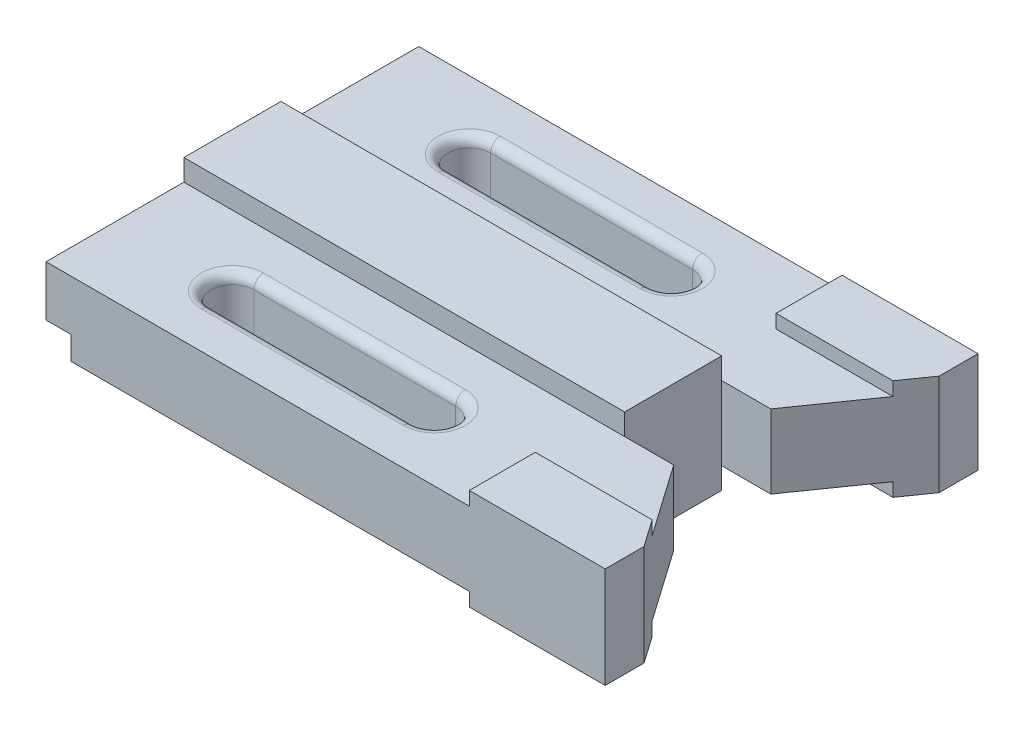
from build123d import *

# Parameters (mm, degrees)
ESQUISSE1_W                  = 113.5
ESQUISSE1_H                  = 25
BOSS_EXTRU_1_DEPTH           = 15
BOSS_EXTRU_2_DEPTH           = 9.5
BOSS_EXTRU_2_DEPTH_BACK      = 9.5
BOSS_EXTRU_3_DEPTH           = 13
ENL_V_MAT_EXTRU_1_DEPTH      = 125.142055726
ENL_V_MAT_EXTRU_1_DEPTH_BACK = 125.142055726
ESQUISSE2_W                  = 6.5
ESQUISSE2_H                  = 11.5
CONG_1_R                     = 2.5


with BuildPart() as part:
    # Esquisse1 → Boss.-Extru.1 (new, symmetric)
    with BuildSketch(Plane(origin=(0, 0, 0), x_dir=(1, 0, 0), z_dir=(0, 1, 0))):
        with Locations((-56.75, 0)):
            Rectangle(ESQUISSE1_W, ESQUISSE1_H)
    extrude(amount=BOSS_EXTRU_1_DEPTH, both=True)

    # Esquisse1<3> → Boss.-Extru.2 (add, two sides: drawn at the far end of the back side and taken through both)
    # profile 1 of 2: a face of its own
    with BuildSketch(Plane(origin=(0, 0, 0), x_dir=(1, 0, 0), z_dir=(0, 1, 0)).offset(-BOSS_EXTRU_2_DEPTH_BACK)):
        Polygon((12.644707776, -12.5), (0, -12.5), (-113.5, -12.5), (-113.5, -48), (-4.5, -48), (-4.5, -31), (25.598547233, -31), align=None)
        with BuildLine():
            Line((-31, -36), (-83, -36))
            ThreePointArc((-83, -36), (-88.5, -30.5), (-83, -25))
            Line((-83, -25), (-31, -25))
            ThreePointArc((-31, -25), (-25.5, -30.5), (-31, -36))
        make_face(mode=Mode.SUBTRACT)
    # profile 2 of 2: a face of its own
    with BuildSketch(Plane(origin=(0, 0, 0), x_dir=(1, 0, 0), z_dir=(0, 1, 0)).offset(-BOSS_EXTRU_2_DEPTH_BACK)):
        Polygon((-113.5, 12.5), (0, 12.5), (12.644707776, 12.5), (25.598547233, 31), (-4.5, 31), (-4.5, 48), (-113.5, 48), align=None)
        with BuildLine():
            ThreePointArc((-83, 25), (-88.5, 30.5), (-83, 36))
            Line((-83, 36), (-31, 36))
            ThreePointArc((-31, 36), (-25.5, 30.5), (-31, 25))
            Line((-31, 25), (-83, 25))
        make_face(mode=Mode.SUBTRACT)
    extrude(amount=BOSS_EXTRU_2_DEPTH + BOSS_EXTRU_2_DEPTH_BACK)

    # Esquisse1<4> → Boss.-Extru.3 (add, symmetric)
    with BuildSketch(Plane(origin=(0, 0, 0), x_dir=(1, 0, 0), z_dir=(0, 1, 0))):
        Polygon((-4.5, 31), (25.598547233, 31), (30.5, 38), (30.5, 48), (-4.5, 48), align=None)
        Polygon((30.5, -38), (25.598547233, -31), (-4.5, -31), (-4.5, -48), (30.5, -48), align=None)
    extrude(amount=BOSS_EXTRU_3_DEPTH, both=True)

    # Esquisse2 → Enlèv. mat.-Extru.1 (cut, two sides: drawn at the far end of the back side and taken through both)
    with BuildSketch(Plane.XY.offset(-ENL_V_MAT_EXTRU_1_DEPTH_BACK)):
        with Locations((-110.25, -9.25)):
            Rectangle(ESQUISSE2_W, ESQUISSE2_H)
    extrude(amount=ENL_V_MAT_EXTRU_1_DEPTH + ENL_V_MAT_EXTRU_1_DEPTH_BACK, mode=Mode.SUBTRACT)

    # Congé1
    cong_1_edges = [part.edges().sort_by_distance(p)[0] for p in [
        (-57, 9.5, 36),
        (-57, -9.5, 36),
        (-88.5, 9.5, 30.5),
        (-57, 9.5, 25),
        (-25.5, 9.5, 30.5),
        (-57, -9.5, 25),
        (-88.5, -9.5, 30.5),
        (-25.5, -9.5, 30.5),
        (-25.5, 9.5, -30.5),
        (-25.5, -9.5, -30.5),
        (-57, 9.5, -25),
        (-57, -9.5, -25),
        (-88.5, 9.5, -30.5),
        (-88.5, -9.5, -30.5),
        (-57, 9.5, -36),
        (-57, -9.5, -36),
    ]]
    fillet(cong_1_edges, radius=CONG_1_R)


solid = part.part
